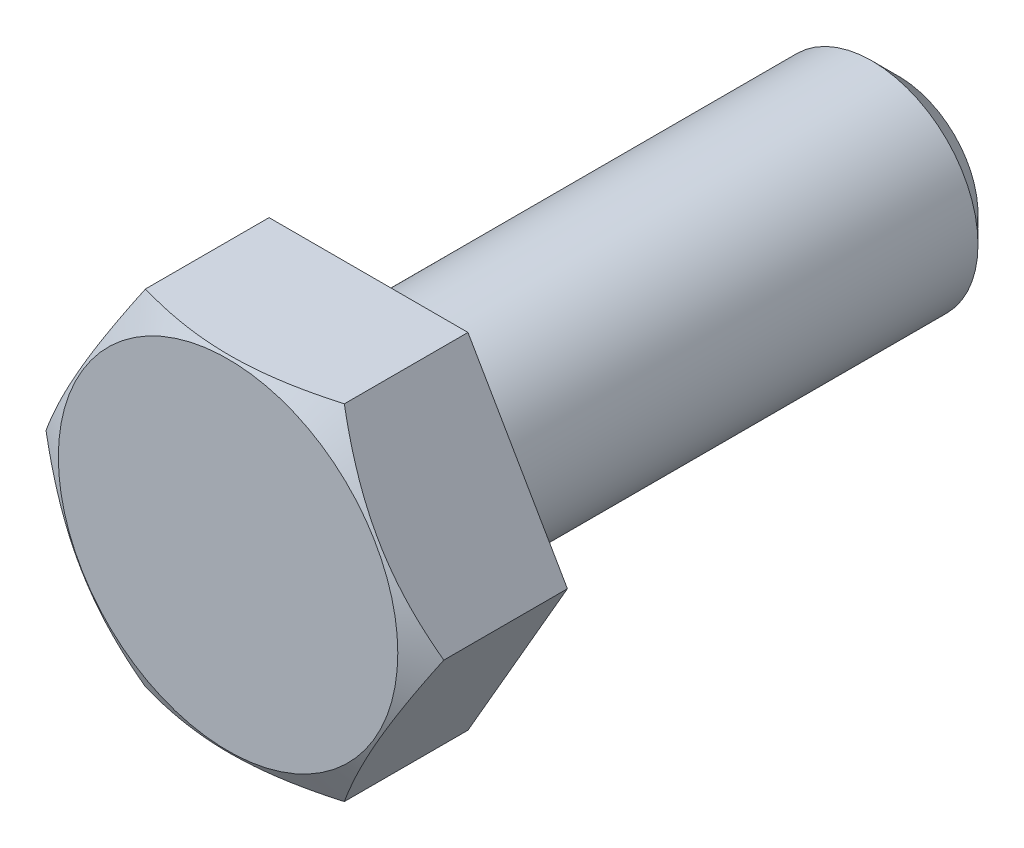
from build123d import *

# Parameters (mm, degrees)
EXTRUDE_1_DEPTH = 5.3
SKETCH_2_R      = 4
EXTRUDE_2_DEPTH = 20
CHAMFER_1_SIZE  = 1


with BuildPart() as part:
    # Эскиз1 → Бобышка-Вытянуть1 (new body)
    with BuildSketch(Plane.XY):
        Polygon((7.505553499, 0), (3.75277675, 6.5), (-3.75277675, 6.5), (-7.505553499, 0), (-3.75277675, -6.5), (3.75277675, -6.5), align=None)
    extrude(amount=EXTRUDE_1_DEPTH)

    # Эскиз2 → Бобышка-Вытянуть2 (add)
    with BuildSketch(Plane(origin=(0, 0, 0), x_dir=(-1, 0, 0), z_dir=(0, 0, -1))):
        with Locations(Location((0, 0, 0), (0, 0, 180))):
            Circle(SKETCH_2_R)
    extrude(amount=EXTRUDE_2_DEPTH)

    # Фаска1
    chamfer_1_edges = [part.edges().sort_by_distance(p)[0] for p in [
        (-4, 0, -20),
    ]]
    chamfer(chamfer_1_edges, length=CHAMFER_1_SIZE)

    # Эскиз3 → Вырез-Повернуть1 (revolve, cut)
    with BuildSketch(Plane(origin=(0, 0, 0), x_dir=(1, 0, 0), z_dir=(0, 1, 0))):
        Polygon((-12.505553499, -1.778163358), (-6.405553499, -5.3), (-12.505553499, -5.3), align=None)
    revolve(axis=Axis((0, 0, 5.3), (0, 0, -1)), mode=Mode.SUBTRACT)


solid = part.part
